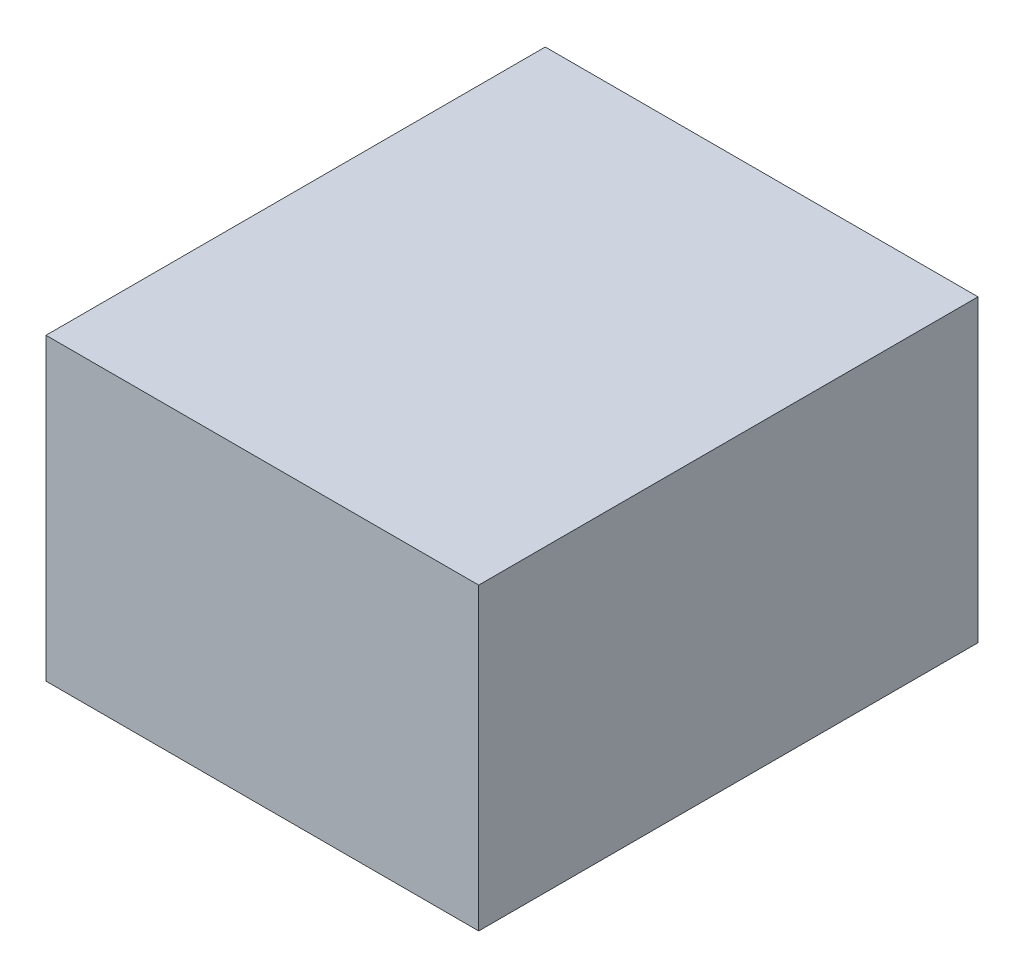
from build123d import *

# Parameters (mm, degrees)
BOSS_EXTRU_1_DEPTH = 18


with BuildPart() as part:
    # Esquisse1 → Boss.-Extru.1 (new body)
    with BuildSketch(Plane(origin=(0, 0, 0), x_dir=(1, 0, 0), z_dir=(0, 1, 0))):
        Polygon((12.873508353, 12.207637232), (6.873508353, 12.207637232), (3.873508353, 12.207637232), (-3.126491647, 12.207637232), (-3.126491647, -12.792362768), (-3.126491647, -17.792362768), (6.873508353, -17.792362768), (12.873508353, -17.792362768), (22.873508353, -17.792362768), (22.873508353, -12.792362768), (22.873508353, 12.207637232), (15.873508353, 12.207637232), align=None)
    extrude(amount=BOSS_EXTRU_1_DEPTH)


solid = part.part
